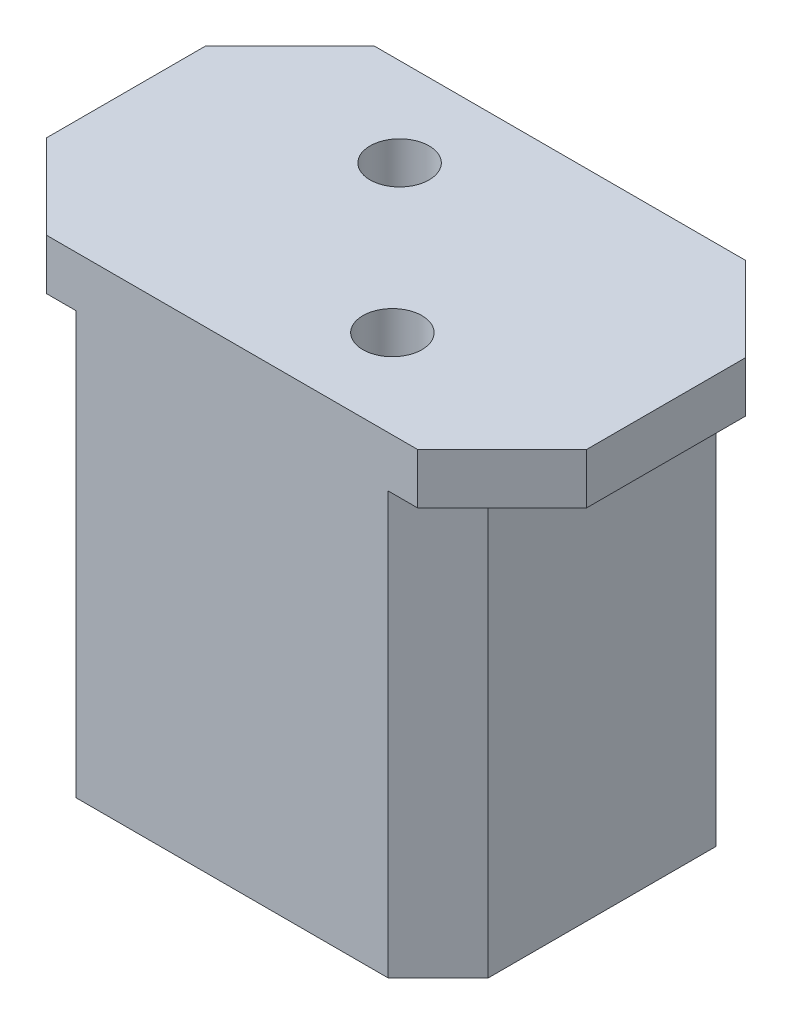
from build123d import *

# Parameters (mm, degrees)
BOSS_EXTRUDE1_DEPTH = 25
SKETCH5_W           = 8.5
SKETCH5_H           = 8.5
CUT_EXTRUDE1_DEPTH  = 20
SKETCH6_R           = 1.75
CUT_EXTRUDE2_DEPTH  = 13
SKETCH7_R           = 1.75
CUT_EXTRUDE3_DEPTH  = 13
SKETCH8_W           = 32
SKETCH8_H           = 19.425554826
SKETCH8_R           = 1.75
BOSS_EXTRUDE2_DEPTH = 3
CHAMFER3_SIZE       = 5


with BuildPart() as part:
    # Sketch2 → Boss-Extrude1 (new body)
    with BuildSketch(Plane(origin=(0, 0, 0), x_dir=(1, 0, 0), z_dir=(0, 1, 0))):
        Polygon((0, 0), (0, 13.5), (2.962777413, 16.462777413), (21.462777413, 16.462777413), (24.425554826, 13.5), (24.425554826, 0), (21.462777413, -2.962777413), (2.962777413, -2.962777413), align=None)
    extrude(amount=BOSS_EXTRUDE1_DEPTH)

    # Sketch5 → Cut-Extrude1 (cut)
    with BuildSketch(Plane(origin=(0, 0, 0), x_dir=(-1, 0, 0), z_dir=(0, -1, 0))):
        with Locations((-7.962777413, 11.212777413)):
            Rectangle(SKETCH5_W, SKETCH5_H)
        with Locations((-16.462777413, 2.287222587)):
            Rectangle(SKETCH5_W, SKETCH5_H)
    extrude(amount=-CUT_EXTRUDE1_DEPTH, mode=Mode.SUBTRACT)

    # Sketch6 → Cut-Extrude2 (cut)
    with BuildSketch(Plane(origin=(0, 20, 0), x_dir=(-1, 0, 0), z_dir=(0, -1, 0))):
        with Locations(Location((-7.962777413, 11.212777413, 0), (0, 0, 90))):
            Circle(SKETCH6_R)
    extrude(amount=-CUT_EXTRUDE2_DEPTH, mode=Mode.SUBTRACT)

    # Sketch7 → Cut-Extrude3 (cut)
    with BuildSketch(Plane.XZ.offset(-20)):
        with Locations(Location((16.462777413, -2.287222587, 0), (0, 0, 270))):
            Circle(SKETCH7_R)
    extrude(amount=-CUT_EXTRUDE3_DEPTH, mode=Mode.SUBTRACT)

    # Sketch8 → Boss-Extrude2 (add)
    with BuildSketch(Plane(origin=(0, 25, 0), x_dir=(1, 0, 0), z_dir=(0, 1, 0))):
        with Locations((12.212777413, 6.75)):
            Rectangle(SKETCH8_W, SKETCH8_H)
        with Locations(Location((7.962777413, 11.212777413, 0), (0, 0, 90))):
            Circle(SKETCH8_R, mode=Mode.SUBTRACT)
        with Locations(Location((16.462777413, 2.287222587, 0), (0, 0, 90))):
            Circle(SKETCH8_R, mode=Mode.SUBTRACT)
    extrude(amount=BOSS_EXTRUDE2_DEPTH)

    # Chamfer3
    chamfer3_edges = [part.edges().sort_by_distance(p)[0] for p in [
        (28.212777413, 26.5, 2.962777413),
        (28.212777413, 26.5, -16.462777413),
        (-3.787222587, 26.5, -16.462777413),
        (-3.787222587, 26.5, 2.962777413),
    ]]
    chamfer(chamfer3_edges, length=CHAMFER3_SIZE)


solid = part.part
